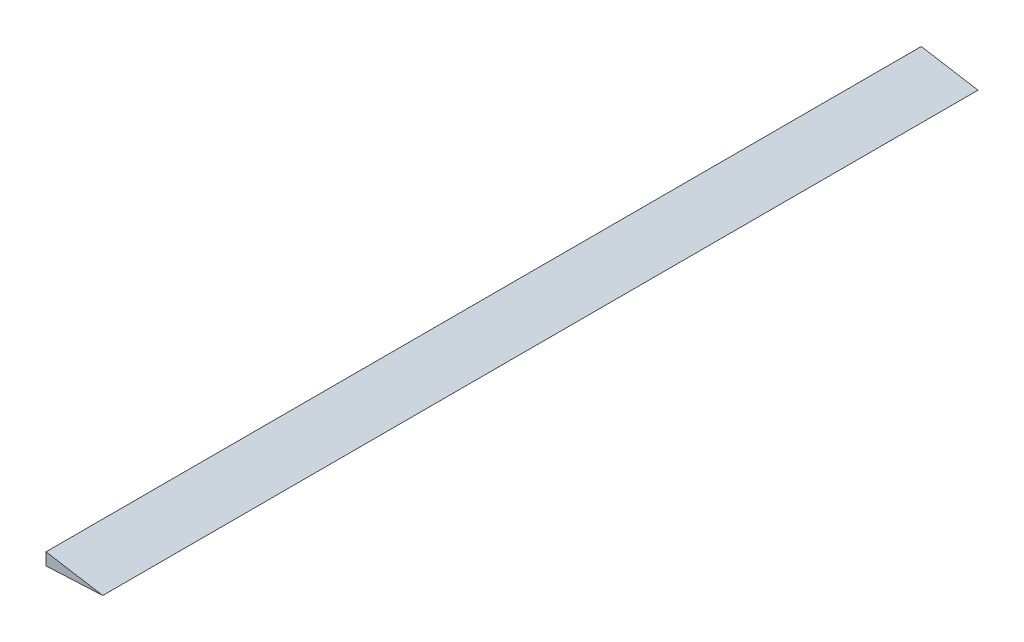
from build123d import *

# Parameters (mm, degrees)
BOSS_EXTRUDE2_DEPTH = 783.336


with BuildPart() as part:
    # Sketch2 → Boss-Extrude2 (new body)
    with BuildSketch(Plane(origin=(0, 0, -761.999746), x_dir=(-1, 0, 0), z_dir=(0, 0, -1))):
        Polygon((-306.8495768, -2.516115741), (-306.8495768, 8.449856001), (-357.6495768, 0), align=None)
    extrude(amount=-BOSS_EXTRUDE2_DEPTH)


solid = part.part
